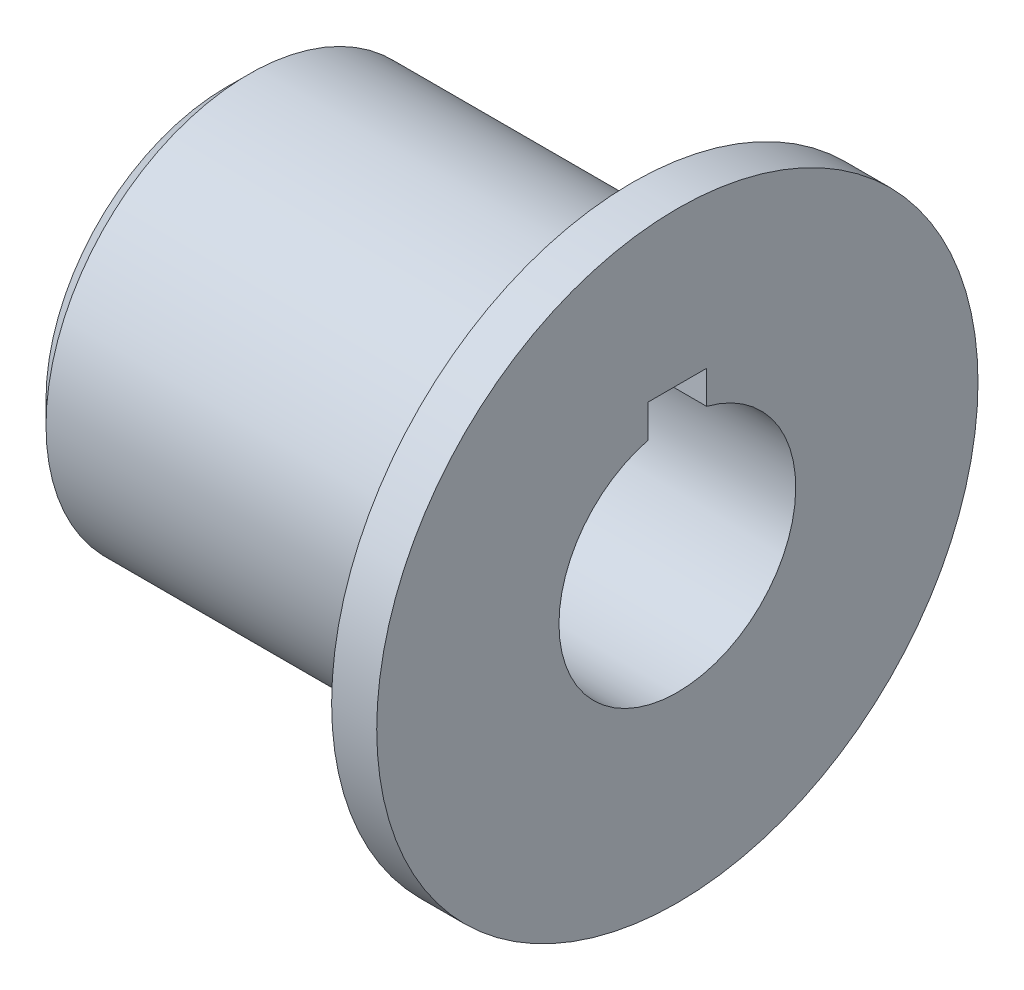
from build123d import *

# Parameters (mm, degrees)
CHAMFER1_SIZE  = 0.762
EXTRUDE1_DEPTH = 0.9906


with BuildPart() as part:
    # Sketch1 → Revolve1 (revolve)
    with BuildSketch(Plane.XY, mode=Mode.PRIVATE) as revolve1_sk:
        Polygon((0, 0), (0, 6.858), (13.716, 6.858), (13.716, 10.16), (15.24, 10.16), (15.24, 4.0005), (9.525, 4.0005), (9.525, 0), align=None)
    revolve(revolve1_sk.sketch.rotate(Axis((0, 0, 0), (1, 0, 0)), 90), axis=Axis((0, 0, 0), (1, 0, 0)))

    # Chamfer1
    chamfer1_edges = [part.edges().sort_by_distance(p)[0] for p in [
        (0, 0, -6.858),
    ]]
    chamfer(chamfer1_edges, length=CHAMFER1_SIZE)

    # Sketch3 → Extrude1 (cut, symmetric)
    with BuildSketch(Plane.XY):
        with BuildLine():
            Line((15.24, 4.9911), (11.519183101, 4.9911))
            ThreePointArc((11.519183101, 4.9911), (10.363552883, 4.677488096), (9.525, 3.8227))
            Line((9.525, 3.8227), (15.24, 3.8227))
            Line((15.24, 3.8227), (15.24, 4.9911))
        make_face()
    extrude(amount=EXTRUDE1_DEPTH, both=True, mode=Mode.SUBTRACT)


solid = part.part
